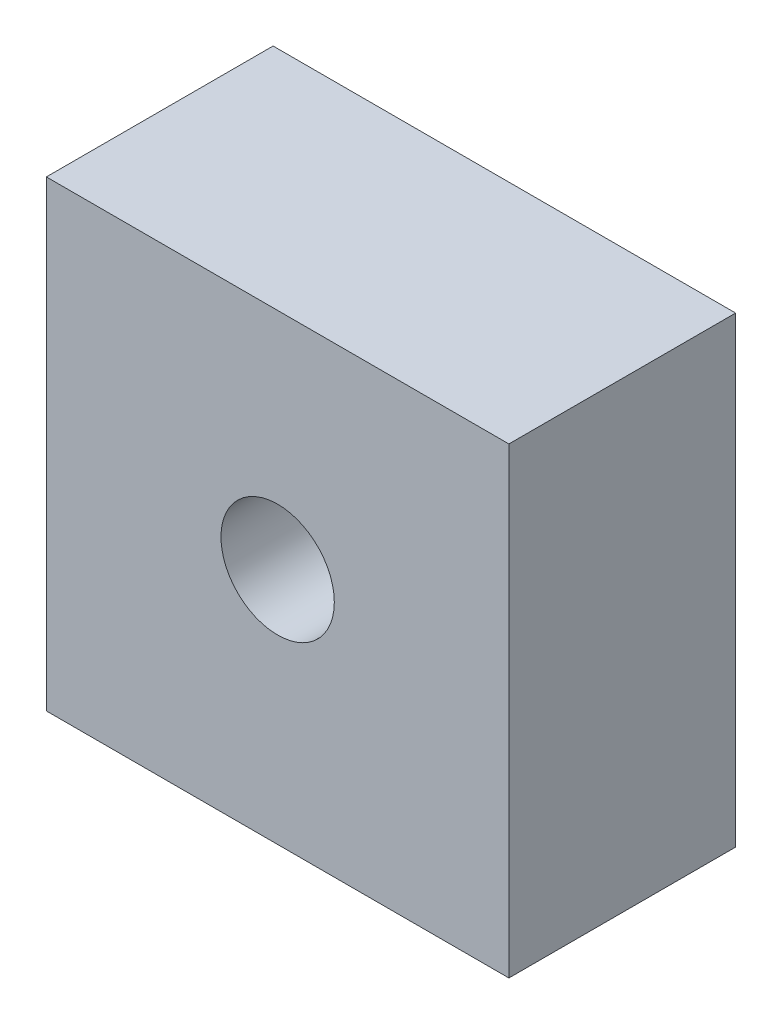
from build123d import *

# Parameters (mm, degrees)
SKETCH2_W           = 40.8
SKETCH2_H           = 40.8
SKETCH2_R           = 1.3
SKETCH2_R_2         = 5
BOSS_EXTRUDE1_DEPTH = 20
SKETCH3_R           = 2.5
BOSS_EXTRUDE2_DEPTH = 5
SKETCH9_R           = 1.5
CUT_EXTRUDE6_DEPTH  = 3


with BuildPart() as part:
    # Sketch2 → Boss-Extrude1 (new body)
    # profile 1 of 5: a face of its own
    with BuildSketch(Plane.XY):
        with Locations((0, -0.3)):
            Rectangle(SKETCH2_W, SKETCH2_H)
        with Locations((-17.4, 17.7)):
            Circle(SKETCH2_R, mode=Mode.SUBTRACT)
        with Locations((0, 0.3)):
            Circle(SKETCH2_R_2, mode=Mode.SUBTRACT)
        with Locations((17.4, 17.7)):
            Circle(SKETCH2_R, mode=Mode.SUBTRACT)
        with Locations((17.4, -17.1)):
            Circle(SKETCH2_R, mode=Mode.SUBTRACT)
        with Locations((-17.4, -17.1)):
            Circle(SKETCH2_R, mode=Mode.SUBTRACT)
    # profile 2 of 5: a face of its own
    with BuildSketch(Plane.XY):
        with Locations((17.4, 17.7)):
            Circle(SKETCH2_R)
    # profile 3 of 5: a face of its own
    with BuildSketch(Plane.XY):
        with Locations((-17.4, -17.1)):
            Circle(SKETCH2_R)
    # profile 4 of 5: a face of its own
    with BuildSketch(Plane.XY):
        with Locations((-17.4, 17.7)):
            Circle(SKETCH2_R)
    # profile 5 of 5: a face of its own
    with BuildSketch(Plane.XY):
        with Locations((17.4, -17.1)):
            Circle(SKETCH2_R)
    extrude(amount=BOSS_EXTRUDE1_DEPTH)

    # Sketch3 → Boss-Extrude2 (add)
    with BuildSketch(Plane.XZ.offset(20.7)):
        with Locations(Location((5, 10, 0), (0, 0, 270))):
            Circle(SKETCH3_R)
        with Locations(Location((-5, 10, 0), (0, 0, 270))):
            Circle(SKETCH3_R)
    extrude(amount=BOSS_EXTRUDE2_DEPTH)

    # Sketch9 → Cut-Extrude6 (cut)
    with BuildSketch(Plane(origin=(0, 0, 0), x_dir=(-1, 0, 0), z_dir=(0, 0, -1))):
        with Locations((-17.4, 17.7)):
            Circle(SKETCH9_R)
        with Locations((17.4, 17.7)):
            Circle(SKETCH9_R)
        with Locations((17.4, -17.1)):
            Circle(SKETCH9_R)
        with Locations((-17.4, -17.1)):
            Circle(SKETCH9_R)
    extrude(amount=-CUT_EXTRUDE6_DEPTH, mode=Mode.SUBTRACT)


solid = part.part
